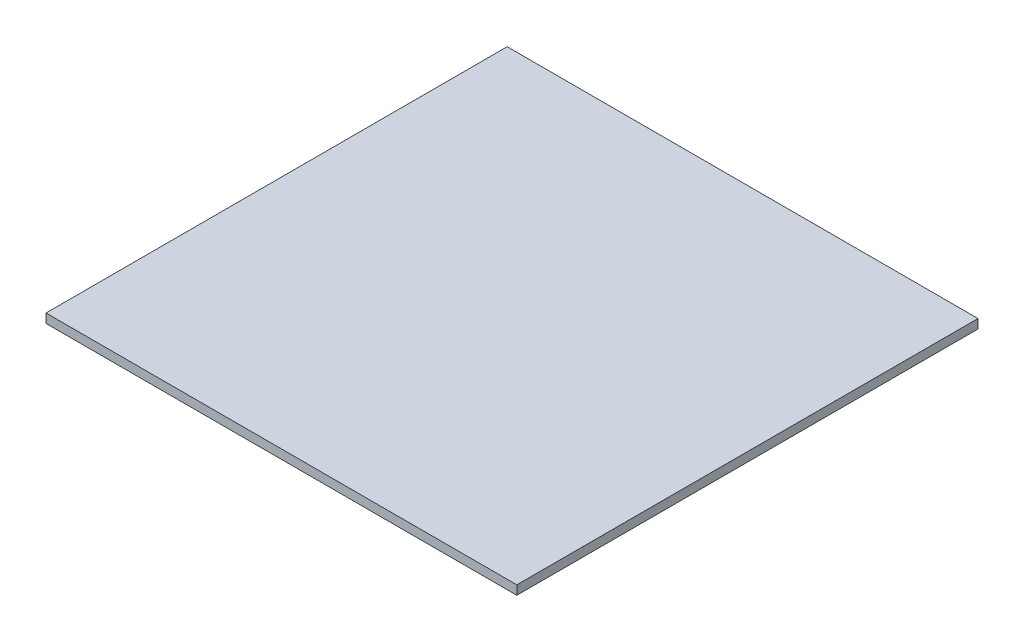
from build123d import *

# Parameters (mm, degrees)
SKETCH1_W           = 311.15
SKETCH1_H           = 304.8
BOSS_EXTRUDE1_DEPTH = 6


with BuildPart() as part:
    # Sketch1 → Boss-Extrude1 (new body)
    with BuildSketch(Plane(origin=(0, 0, 0), x_dir=(1, 0, 0), z_dir=(0, 1, 0))):
        with Locations((155.575, 152.4)):
            Rectangle(SKETCH1_W, SKETCH1_H)
    extrude(amount=BOSS_EXTRUDE1_DEPTH)


solid = part.part
